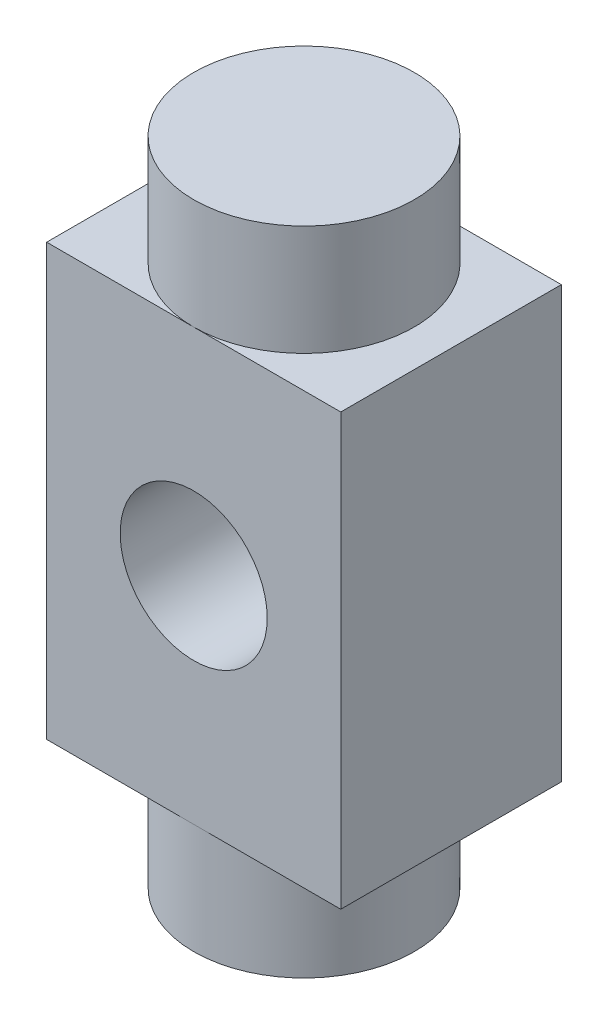
from build123d import *

# Parameters (mm, degrees)
SKETCH_1_W      = 4
SKETCH_1_H      = 5.856888772
SKETCH_1_R      = 0.999999985
EXTRUDE_1_DEPTH = 3
SKETCH_2_R      = 1.5
EXTRUDE_2_DEPTH = 1.5


with BuildPart() as part:
    # 草图1 → 凸台-拉伸1 (new body)
    with BuildSketch(Plane.XY):
        Rectangle(SKETCH_1_W, SKETCH_1_H)
        Circle(SKETCH_1_R, mode=Mode.SUBTRACT)
    extrude(amount=EXTRUDE_1_DEPTH)

    # 草图2 → 凸台-拉伸2 (add)
    with BuildSketch(Plane(origin=(0, 2.928444386, 0), x_dir=(1, 0, 0), z_dir=(0, 1, 0))):
        with Locations(Location((0, -1.5, 0), (0, 0, 270))):
            Circle(SKETCH_2_R)
    extrude_2 = extrude(amount=EXTRUDE_2_DEPTH)

    # 镜向1: 凸台-拉伸2 across plane
    add(extrude_2.mirror(Plane.ZX))


solid = part.part
